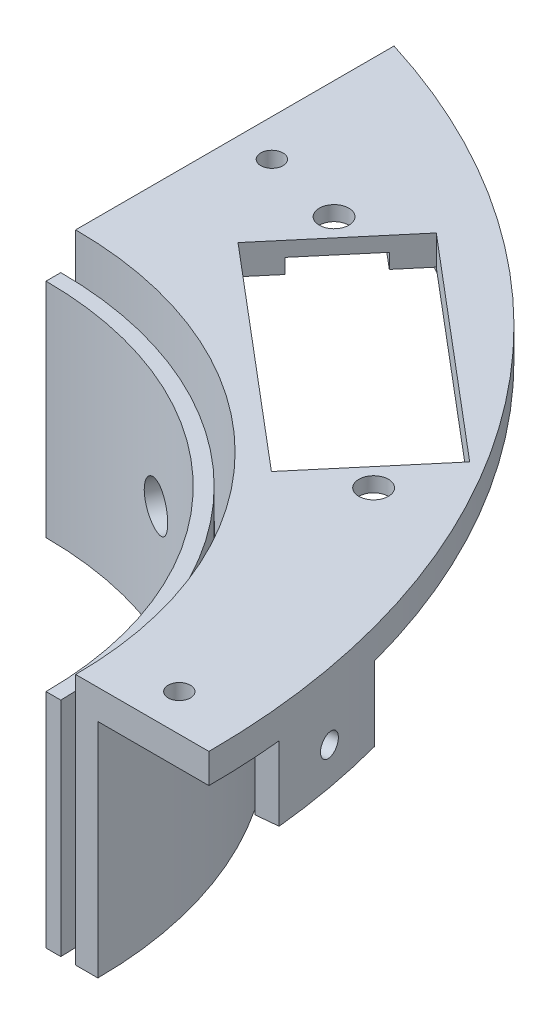
from build123d import *
from build123d.topology import SkipClean

# Parameters (mm, degrees)
BOSS_EXTRUDE1_DEPTH                  = 15
BOSS_EXTRUDE3_DEPTH                  = 15
BOSS_EXTRUDE4_REACH                  = 61.954
BOSS_EXTRUDE4_END_RADIUS             = 52
SKETCH2_R                            = 5.6
BOSS_EXTRUDE4_DIRECTION_2_REACH      = 61.954
BOSS_EXTRUDE4_DIRECTION_2_END_RADIUS = 50
BOSS_EXTRUDE5_REACH                  = 61.954
BOSS_EXTRUDE5_END_RADIUS             = 52
SKETCH4_R                            = 5.6
BOSS_EXTRUDE5_DIRECTION_2_REACH      = 61.954
BOSS_EXTRUDE5_DIRECTION_2_END_RADIUS = 50
CUT_EXTRUDE1_DEPTH                   = 60.953724142
CUT_EXTRUDE1_DEPTH_BACK              = 60.953724142
SKETCH5_R                            = 1.5
SKETCH6_R                            = 3
CUT_EXTRUDE2_DEPTH                   = 60.953724142
CUT_EXTRUDE3_DEPTH                   = 60.953724142
CUT_EXTRUDE3_DEPTH_BACK              = 60.953724142
SKETCH7_R                            = 1.5
SKETCH8_R                            = 3
CUT_EXTRUDE4_DEPTH                   = 60.953724142
BOSS_EXTRUDE6_DEPTH                  = 4
CUT_EXTRUDE5_DEPTH                   = 4
SKETCH12_R                           = 2
SKETCH12_R_2                         = 1.5
CUT_EXTRUDE6_DEPTH                   = 92.433035695
CUT_EXTRUDE7_START                   = -4
CUT_EXTRUDE7_DEPTH                   = 2
SKETCH15_R                           = 1.5
CUT_EXTRUDE8_DEPTH                   = 73.818757804
SKETCH17_R                           = 1.5
CUT_EXTRUDE9_DEPTH                   = 91.348080245
BOSS_EXTRUDE7_DEPTH                  = 10
CUT_EXTRUDE10_REACH                  = 106.962
CUT_EXTRUDE10_END_RADIUS             = 96.464285714
SKETCH21_R                           = 1.5
CUT_EXTRUDE11_REACH                  = 106.962
CUT_EXTRUDE11_END_RADIUS             = 96.464285714
SKETCH22_R                           = 1.5


with BuildPart() as part:
    # Sketch1 → Boss-Extrude1 (new, symmetric)
    with BuildSketch(Plane(origin=(0, 0, 0), x_dir=(1, 0, 0), z_dir=(0, 1, 0))):
        with BuildLine():
            Line((0, 0), (0, 2))
            ThreePointArc((0, 2), (35.355339059, -12.644660941), (50, -48))
            Line((50, -48), (48, -48))
            ThreePointArc((48, -48), (33.941125497, -14.058874503), (0, 0))
        make_face()
    extrude(amount=BOSS_EXTRUDE1_DEPTH, both=True)

    # Boss-Extrude4: up to this cylinder (the profile starts inside it)
    boss_extrude4_end = Plane(origin=(0, 0, 48), z_dir=(0, -1, 0)) * Cylinder(BOSS_EXTRUDE4_END_RADIUS, 228.908, mode=Mode.PRIVATE)
    # Sketch2 → Boss-Extrude4 (add, up to the surface)
    with BuildSketch(Plane(origin=(19.595917942, 0, 2), x_dir=(-0.9200000000000002, 0, -0.3919183588453084), z_dir=(0.39191835884530835, 0, -0.92)), mode=Mode.PRIVATE) as boss_extrude4_sk1:
        with Locations(Location((0, 0, 0), (0, 0, 180))):
            Circle(SKETCH2_R)
    boss_extrude4_tool1 = extrude(boss_extrude4_sk1.sketch, amount=BOSS_EXTRUDE4_REACH, mode=Mode.PRIVATE) & boss_extrude4_end
    add(boss_extrude4_tool1.solids().sort_by_distance((19.595918, 0, 2))[0])

    # Boss-Extrude4 direction 2: up to this cylinder (the profile starts outside it)
    with SkipClean():  # the faces are left unmerged after this step: merging them gives an invalid solid
        boss_extrude4_direction_2_end = Plane(origin=(0, 0, 48), z_dir=(0, -1, 0)) * Cylinder(BOSS_EXTRUDE4_DIRECTION_2_END_RADIUS, 224.908, mode=Mode.PRIVATE)
        # Sketch2 → Boss-Extrude4 direction 2 (add, up to the surface)
        with BuildSketch(Plane(origin=(19.595917942, 0, 2), x_dir=(-0.9200000000000002, 0, -0.3919183588453084), z_dir=(0.39191835884530835, 0, -0.92)), mode=Mode.PRIVATE) as boss_extrude4_direction_2_sk1:
            with Locations(Location((0, 0, 0), (0, 0, 180))):
                Circle(SKETCH2_R)
        boss_extrude4_direction_2_tool1 = extrude(boss_extrude4_direction_2_sk1.sketch, amount=-BOSS_EXTRUDE4_DIRECTION_2_REACH, mode=Mode.PRIVATE) - boss_extrude4_direction_2_end
        add(boss_extrude4_direction_2_tool1.solids().sort_by_distance((19.595918, 0, 2))[0])
        add(boss_extrude4_direction_2_tool1.solids().sort_by_distance((19.595918, 0, 2))[1])

    # Boss-Extrude5: up to this cylinder (the profile starts inside it)
    with SkipClean():  # the faces are left unmerged after this step: merging them gives an invalid solid
        boss_extrude5_end = Plane(origin=(0, 0, 48), z_dir=(0, -1, 0)) * Cylinder(BOSS_EXTRUDE5_END_RADIUS, 228.908, mode=Mode.PRIVATE)
        # Sketch4 → Boss-Extrude5 (add, up to the surface)
        with BuildSketch(Plane(origin=(46, 0, 28.404082058), x_dir=(-0.3919183588453085, 0, -0.92), z_dir=(0.9199999999999999, 0, -0.39191835884530846)), mode=Mode.PRIVATE) as boss_extrude5_sk1:
            with Locations(Location((0, 0, 0), (0, 0, 180))):
                Circle(SKETCH4_R)
        boss_extrude5_tool1 = extrude(boss_extrude5_sk1.sketch, amount=BOSS_EXTRUDE5_REACH, mode=Mode.PRIVATE) & boss_extrude5_end
        add(boss_extrude5_tool1.solids().sort_by_distance((46, 0, 28.404082))[0])

    # Boss-Extrude5 direction 2: up to this cylinder (the profile starts outside it)
    with SkipClean():  # the faces are left unmerged after this step: merging them gives an invalid solid
        boss_extrude5_direction_2_end = Plane(origin=(0, 0, 48), z_dir=(0, -1, 0)) * Cylinder(BOSS_EXTRUDE5_DIRECTION_2_END_RADIUS, 224.908, mode=Mode.PRIVATE)
        # Sketch4 → Boss-Extrude5 direction 2 (add, up to the surface)
        with BuildSketch(Plane(origin=(46, 0, 28.404082058), x_dir=(-0.3919183588453085, 0, -0.92), z_dir=(0.9199999999999999, 0, -0.39191835884530846)), mode=Mode.PRIVATE) as boss_extrude5_direction_2_sk1:
            with Locations(Location((0, 0, 0), (0, 0, 180))):
                Circle(SKETCH4_R)
        boss_extrude5_direction_2_tool1 = extrude(boss_extrude5_direction_2_sk1.sketch, amount=-BOSS_EXTRUDE5_DIRECTION_2_REACH, mode=Mode.PRIVATE) - boss_extrude5_direction_2_end
        add(boss_extrude5_direction_2_tool1.solids().sort_by_distance((46, 0, 28.404082))[0])
        add(boss_extrude5_direction_2_tool1.solids().sort_by_distance((46, 0, 28.404082))[1])

    # Sketch5 → Cut-Extrude1 (cut, two sides: drawn at the far end of the back side and taken through both)
    with SkipClean():  # the faces are left unmerged after this step: merging them gives an invalid solid
        with BuildSketch(Plane(origin=(19.595917942, 0, 2), x_dir=(-0.9200000000000002, 0, -0.3919183588453084), z_dir=(0.39191835884530835, 0, -0.92)).offset(-CUT_EXTRUDE1_DEPTH_BACK)):
            Circle(SKETCH5_R)
        extrude(amount=CUT_EXTRUDE1_DEPTH + CUT_EXTRUDE1_DEPTH_BACK, mode=Mode.SUBTRACT)

    # Sketch6 → Cut-Extrude2 (cut, through all)
    with SkipClean():  # the faces are left unmerged after this step: merging them gives an invalid solid
        with BuildSketch(Plane(origin=(19.595917942, 0, 2), x_dir=(-0.9200000000000002, 0, -0.3919183588453084), z_dir=(0.39191835884530835, 0, -0.92))):
            Circle(SKETCH6_R)
        extrude(amount=-CUT_EXTRUDE2_DEPTH, mode=Mode.SUBTRACT)

    # Sketch7 → Cut-Extrude3 (cut, two sides: drawn at the far end of the back side and taken through both)
    with SkipClean():  # the faces are left unmerged after this step: merging them gives an invalid solid
        with BuildSketch(Plane(origin=(46, 0, 28.404082058), x_dir=(-0.3919183588453085, 0, -0.92), z_dir=(0.9199999999999999, 0, -0.39191835884530846)).offset(-CUT_EXTRUDE3_DEPTH_BACK)):
            Circle(SKETCH7_R)
        extrude(amount=CUT_EXTRUDE3_DEPTH + CUT_EXTRUDE3_DEPTH_BACK, mode=Mode.SUBTRACT)

    # Sketch8 → Cut-Extrude4 (cut, through all)
    with SkipClean():  # the faces are left unmerged after this step: merging them gives an invalid solid
        with BuildSketch(Plane(origin=(46, 0, 28.404082058), x_dir=(-0.3919183588453085, 0, -0.92), z_dir=(0.9199999999999999, 0, -0.39191835884530846))):
            Circle(SKETCH8_R)
        extrude(amount=-CUT_EXTRUDE4_DEPTH, mode=Mode.SUBTRACT)


with BuildPart() as body_2:
    # Sketch3 → Boss-Extrude3 (new, symmetric)
    with BuildSketch(Plane(origin=(0, 0, 0), x_dir=(1, 0, 0), z_dir=(0, 1, 0))):
        with BuildLine():
            Line((0, 4), (0, 7))
            ThreePointArc((0, 7), (38.890872965, -9.109127035), (55, -48))
            Line((55, -48), (52, -48))
            ThreePointArc((52, -48), (36.769552622, -11.230447378), (0, 4))
        make_face()
    extrude(amount=BOSS_EXTRUDE3_DEPTH, both=True)

    # Sketch9 → Boss-Extrude6 (add)
    with BuildSketch(Plane(origin=(0, 15, 0), x_dir=(1, 0, 0), z_dir=(0, 1, 0))):
        with BuildLine():
            Line((0, 4), (0, 47))
            ThreePointArc((0, 47), (50.610018108, 11.002118606), (70, -48))
            Line((70, -48), (52, -48))
            ThreePointArc((52, -48), (36.769552622, -11.230447378), (0, 4))
        make_face()
    extrude(amount=BOSS_EXTRUDE6_DEPTH)

    # Sketch10 → Cut-Extrude5 (cut)
    with BuildSketch(Plane(origin=(0, 19, 0), x_dir=(1, 0, 0), z_dir=(0, 1, 0))):
        Polygon((12.45520362, 13.472497125), (41.486156545, -11.046959889), (53.745885052, 3.468516574), (24.714932127, 27.987973588), align=None)
    extrude(amount=-CUT_EXTRUDE5_DEPTH, mode=Mode.SUBTRACT)

    # Sketch12 → Cut-Extrude6 (cut, through all)
    with BuildSketch(Plane(origin=(0, 19, 0), x_dir=(1, 0, 0), z_dir=(0, 1, 0))):
        with Locations(Location((15.911164314, 22.988606397, 0), (0, 0, 270))):
            Circle(SKETCH12_R)
        with Locations(Location((50.289924358, -6.047592698, 0), (0, 0, 270))):
            Circle(SKETCH12_R)
        with Locations(Location((5, 25.5, 0), (0, 0, 270))):
            Circle(SKETCH12_R_2)
        with Locations(Location((61, -43, 0), (0, 0, 270))):
            Circle(SKETCH12_R_2)
    extrude(amount=-CUT_EXTRUDE6_DEPTH, mode=Mode.SUBTRACT)

    # Sketch13 → Cut-Extrude7 (cut)
    with BuildSketch(Plane(origin=(0, 19, 0), x_dir=(-1, 0, 0), z_dir=(0, 1, 0)).offset(CUT_EXTRUDE7_START)):
        Polygon((-15.358823529, -16.910373129), (-7.719099075, -23.362861817), (-14.171587763, -31.002586271), (-21.811312217, -24.550097583), align=None)
        Polygon((-58.481989597, 6.421848118), (-50.842265143, -0.03064057), (-44.389776455, 7.609083884), (-52.029500909, 14.061572572), align=None)
    extrude(amount=CUT_EXTRUDE7_DEPTH, mode=Mode.SUBTRACT)

    # Sketch15 → Cut-Extrude8 (cut, through all)
    with BuildSketch(Plane(origin=(19.595917942, 0, 2), x_dir=(-0.9200000000000002, 0, -0.3919183588453084), z_dir=(0.39191835884530835, 0, -0.92))):
        with Locations(Location((0, 0, 0), (0, 0, 180))):
            Circle(SKETCH15_R)
    extrude(amount=CUT_EXTRUDE8_DEPTH, mode=Mode.SUBTRACT)

    # Sketch17 → Cut-Extrude9 (cut, through all)
    with BuildSketch(Plane(origin=(46, 0, 28.404082058), x_dir=(-0.3919183588453085, 0, -0.92), z_dir=(0.9199999999999999, 0, -0.39191835884530846))):
        with Locations(Location((0, 0, 0), (0, 0, 180))):
            Circle(SKETCH17_R)
    extrude(amount=CUT_EXTRUDE9_DEPTH, mode=Mode.SUBTRACT)

    # Sketch19 → Boss-Extrude7 (add)
    with BuildSketch(Plane(origin=(0, 15, 0), x_dir=(-1, 0, 0), z_dir=(0, 1, 0))):
        with BuildLine():
            Line((-66.615538106, 22.274301033), (-63.717618824, 23.050228757))
            ThreePointArc((-63.717618824, 23.050228757), (-65.422459077, 30.625763866), (-66.512469017, 38.313877471))
            Line((-66.512469017, 38.313877471), (-69.497307002, 38.012643005))
            ThreePointArc((-69.497307002, 38.012643005), (-68.373398197, 30.085432198), (-66.615538106, 22.274301033))
        make_face()
        with BuildLine():
            Line((-21.968914555, -33.608727036), (-23.568466137, -36.146725211))
            ThreePointArc((-23.568466137, -36.146725211), (-16.628654889, -40.139576577), (-9.390178773, -43.561316734))
            Line((-9.390178773, -43.561316734), (-8.218266739, -40.799682764))
            ThreePointArc((-8.218266739, -40.799682764), (-15.238418979, -37.481147696), (-21.968914555, -33.608727036))
        make_face()
    extrude(amount=-BOSS_EXTRUDE7_DEPTH)

    # Cut-Extrude10: up to this cylinder (the profile starts outside it)
    cut_extrude10_end = Plane(origin=(-29.464285714, 10, 48), z_dir=(0, 1, 0)) * Cylinder(CUT_EXTRUDE10_END_RADIUS, 407.852571429, mode=Mode.PRIVATE)
    # Sketch21 → Cut-Extrude10 (cut, up to the surface)
    with BuildSketch(Plane(origin=(16.628654889, 5, -40.139576577), x_dir=(-0.8861429602003462, 0, -0.463411970159779), z_dir=(0.463411970159779, 0, -0.8861429602003462)), mode=Mode.PRIVATE) as cut_extrude10_sk1:
        with Locations((0, 5)):
            Circle(SKETCH21_R)
    cut_extrude10_tool1 = extrude(cut_extrude10_sk1.sketch, amount=-CUT_EXTRUDE10_REACH, mode=Mode.PRIVATE) - cut_extrude10_end
    add(cut_extrude10_tool1.solids().sort_by_distance((16.628655, 10, -40.139577))[0], mode=Mode.SUBTRACT)

    # Cut-Extrude11: up to this cylinder (the profile starts outside it)
    cut_extrude11_end = Plane(origin=(-29.464285714, 10, 48), z_dir=(0, 1, 0)) * Cylinder(CUT_EXTRUDE11_END_RADIUS, 407.852571429, mode=Mode.PRIVATE)
    # Sketch22 → Cut-Extrude11 (cut, up to the surface)
    with BuildSketch(Plane(origin=(68.373398197, 5, 30.085432198), x_dir=(-0.1801105559999015, 0, -0.9836463732548433), z_dir=(0.9836463732548432, 0, -0.18011055599990147)), mode=Mode.PRIVATE) as cut_extrude11_sk1:
        with Locations((0, 5)):
            Circle(SKETCH22_R)
    cut_extrude11_tool1 = extrude(cut_extrude11_sk1.sketch, amount=-CUT_EXTRUDE11_REACH, mode=Mode.PRIVATE) - cut_extrude11_end
    add(cut_extrude11_tool1.solids().sort_by_distance((68.373398, 10, 30.085432))[0], mode=Mode.SUBTRACT)


solid = Compound([part.part, body_2.part])
